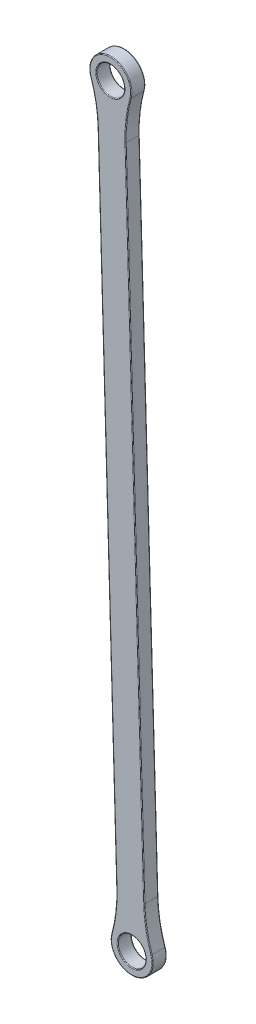
from build123d import *

# Parameters (mm, degrees)
BOSS_EXTRUDE3_DEPTH = 3
FILLET5_R           = 30
FILLET6_R           = 0.15


with BuildPart() as part:
    # Sketch2 → Boss-Extrude3 (new body)
    with BuildSketch(Plane.XY):
        with BuildLine():
            ThreePointArc((33.648285301, 219.519834824), (27.252371234, 223.600951075), (26.245836478, 216.080970066))
            Line((26.245836478, 216.080970066), (26.149522409, 219.433688903))
            ThreePointArc((26.149522409, 219.433688903), (29.062139379, 222.518597716), (32.147048192, 219.605980746))
            Line((32.147048192, 219.605980746), (32.243362261, 216.253261909))
            ThreePointArc((32.243362261, 216.253261909), (33.282160379, 217.741893082), (33.648285301, 219.519834824))
        make_face()
        with BuildLine():
            ThreePointArc((26.245836478, 216.080970066), (27.663960747, 215.271684566), (29.277504183, 215.021690487))
            Line((29.277504183, 215.021690487), (29.234431223, 216.521071933))
            ThreePointArc((29.234431223, 216.521071933), (27.08875409, 217.338474883), (26.149522409, 219.433688903))
            Line((26.149522409, 219.433688903), (26.245836478, 216.080970066))
        make_face()
        with BuildLine():
            Line((29.234431223, 216.521071933), (29.277504183, 215.021690487))
            ThreePointArc((29.277504183, 215.021690487), (30.874035272, 215.36390087), (32.243362261, 216.253261909))
            Line((32.243362261, 216.253261909), (32.147048192, 219.605980746))
            ThreePointArc((32.147048192, 219.605980746), (31.329645242, 217.460303614), (29.234431223, 216.521071933))
        make_face()
        with BuildLine():
            ThreePointArc((30.6476575, 62.852386853), (32.016984489, 63.741747893), (33.613515578, 64.083958275))
            Line((33.613515578, 64.083958275), (29.277504183, 215.021690487))
            ThreePointArc((29.277504183, 215.021690487), (27.663960747, 215.271684566), (26.245836478, 216.080970066))
            Line((26.245836478, 216.080970066), (30.6476575, 62.852386853))
        make_face()
        with BuildLine():
            Line((29.277504183, 215.021690487), (33.613515578, 64.083958275))
            ThreePointArc((33.613515578, 64.083958275), (35.227059015, 63.833964196), (36.645183284, 63.024678697))
            Line((36.645183284, 63.024678697), (32.243362261, 216.253261909))
            ThreePointArc((32.243362261, 216.253261909), (30.874035272, 215.36390087), (29.277504183, 215.021690487))
        make_face()
        with BuildLine():
            ThreePointArc((30.743971569, 59.499668016), (31.561374519, 61.645345148), (33.656588539, 62.58457683))
            Line((33.656588539, 62.58457683), (33.613515578, 64.083958275))
            ThreePointArc((33.613515578, 64.083958275), (32.016984489, 63.741747893), (30.6476575, 62.852386853))
            Line((30.6476575, 62.852386853), (30.743971569, 59.499668016))
        make_face()
        with BuildLine():
            Line((33.613515578, 64.083958275), (33.656588539, 62.58457683))
            ThreePointArc((33.656588539, 62.58457683), (35.802265671, 61.767173879), (36.741497352, 59.67195986))
            Line((36.741497352, 59.67195986), (36.645183284, 63.024678697))
            ThreePointArc((36.645183284, 63.024678697), (35.227059015, 63.833964196), (33.613515578, 64.083958275))
        make_face()
        with BuildLine():
            ThreePointArc((36.741497352, 59.67195986), (33.828880382, 56.587051046), (30.743971569, 59.499668016))
            Line((30.743971569, 59.499668016), (30.6476575, 62.852386853))
            ThreePointArc((30.6476575, 62.852386853), (31.964792718, 55.45193886), (38.24273446, 59.585813938))
            ThreePointArc((38.24273446, 59.585813938), (37.823850711, 61.481728005), (36.645183284, 63.024678697))
            Line((36.645183284, 63.024678697), (36.741497352, 59.67195986))
        make_face()
    extrude(amount=-BOSS_EXTRUDE3_DEPTH)

    # Fillet5
    fillet5_edges = [part.edges().sort_by_distance(p)[0] for p in [
        (30.6476575, 62.852386853, -1.5),
        (26.245836478, 216.080970066, -1.5),
        (32.243362261, 216.253261909, -1.5),
        (36.645183284, 63.024678697, -1.5),
    ]]
    fillet(fillet5_edges, radius=FILLET5_R)

    # Fillet6
    fillet6_edges = [part.edges().sort_by_distance(p)[0] for p in [
        (34.444272772, 139.638970303, 0),
        (34.444272772, 139.638970303, -3),
        (26.149522409, 219.433688903, -3),
        (29.019066418, 224.017979162, 0),
        (29.019066418, 224.017979162, -3),
        (28.446746989, 139.466678459, 0),
        (28.446746989, 139.466678459, -3),
        (33.143223957, 55.125927487, 0),
        (33.143223957, 55.125927487, -3),
        (32.636718656, 213.97867404, 0),
        (30.743971569, 59.499668016, -3),
        (32.636718656, 213.97867404, -3),
        (25.983705892, 213.787551922, 0),
        (25.983705892, 213.787551922, -3),
        (30.254301105, 65.126974722, 0),
        (30.254301105, 65.126974722, -3),
        (36.907313869, 65.31809684, 0),
        (36.907313869, 65.31809684, -3),
        (30.743971569, 59.499668016, 0),
        (26.149522409, 219.433688903, 0),
    ]]
    fillet(fillet6_edges, radius=FILLET6_R)


solid = part.part
